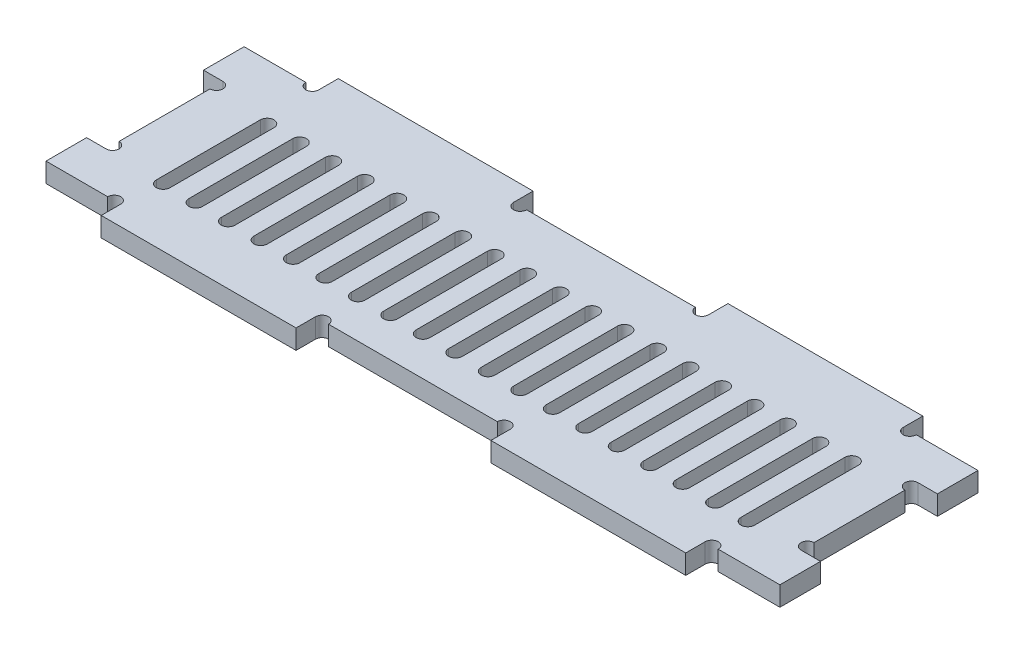
from build123d import *

# Parameters (mm, degrees)
EXTRUDE_1_DEPTH        = 1.5
SKETCH_2_W             = 94.999999969
SKETCH_2_H             = 7.3
CUT_EXTRUDE_1_DEPTH    = 10
SKETCH_4_W             = 94.999999969
SKETCH_4_H             = 4
CUT_EXTRUDE_3_DEPTH    = 10
SKETCH_5_W             = 30
SKETCH_5_H             = 3
EXTRUDE_2_DEPTH        = 3
EXTRUDE_3_DEPTH        = 3
SKETCH_7_R             = 1
CUT_EXTRUDE_4_DEPTH    = 3
CUT_EXTRUDE_5_DEPTH    = 5
PATTERN_LINEAR_1_COUNT = 19
PATTERN_LINEAR_1_PITCH = 5


with BuildPart() as part:
    # 草图1 → 凸台-拉伸1 (new, symmetric)
    with BuildSketch(Plane(origin=(0, 0, 0), x_dir=(1, 0, 0), z_dir=(0, 1, 0))):
        Polygon((-47.5, 26.6), (-47.5, -15.2), (47.499999969, -15.2), (47.499999969, 26.600010084), align=None)
    extrude(amount=EXTRUDE_1_DEPTH, both=True)

    # 草图2 → 切除-拉伸1 (cut)
    with BuildSketch(Plane(origin=(0, 1.5, 0), x_dir=(1, 0, 0), z_dir=(0, 1, 0))):
        with Locations((-1.5e-08, -11.55)):
            Rectangle(SKETCH_2_W, SKETCH_2_H)
    extrude(amount=-CUT_EXTRUDE_1_DEPTH, mode=Mode.SUBTRACT)

    # 草图4 → 切除-拉伸3 (cut)
    with BuildSketch(Plane(origin=(0, 1.5, 0), x_dir=(1, 0, 0), z_dir=(0, 1, 0))):
        with Locations((-1.5e-08, 24.6)):
            Rectangle(SKETCH_4_W, SKETCH_4_H)
    extrude(amount=-CUT_EXTRUDE_3_DEPTH, mode=Mode.SUBTRACT)


with BuildPart() as cut_extrude_3_kept_piece:
    # of the separate pieces the step leaves, the one the design keeps (cut_extrude_3_pieces_kept)
    add(part.part.solids().sort_by_distance((-47.5, 1.5, -22.6))[0])

    # 草图5 → 凸台-拉伸2 (add)
    with BuildSketch(Plane(origin=(0, 0, -22.6), x_dir=(-1, 0, 0), z_dir=(0, 0, -1))):
        with Locations((30, 0)):
            Rectangle(SKETCH_5_W, SKETCH_5_H)
        with Locations((-30, 0)):
            Rectangle(SKETCH_5_W, SKETCH_5_H)
    extrude_2 = extrude(amount=EXTRUDE_2_DEPTH)

    # 镜向1: 凸台-拉伸2 across plane
    add(extrude_2.mirror(Plane(origin=(0, 0, -7.35), x_dir=(1, 0, 0), z_dir=(0, 0, -1))))

    # 草图8 → 凸台-拉伸3 (add)
    with BuildSketch(Plane(origin=(0, 1.5, 0), x_dir=(1, 0, 0), z_dir=(0, 1, 0))):
        Polygon((-47.5, -7.9), (-47.5, 22.6), (-56.5, 22.6), (-56.5, 16.35), (-53.5, 16.35), (-53.5, -1.65), (-56.5, -1.65), (-56.5, -7.9), align=None)
        Polygon((56.5, -7.9), (56.5, -1.65), (53.5, -1.65), (53.5, 16.35), (56.5, 16.35), (56.5, 22.6), (47.5, 22.6), (47.5, -7.9), align=None)
    extrude(amount=-EXTRUDE_3_DEPTH)

    # 草图7 → 切除-拉伸4 (cut)
    with BuildSketch(Plane(origin=(0, 1.5, 0), x_dir=(1, 0, 0), z_dir=(0, 1, 0))):
        with Locations((-14, 22.6)):
            Circle(SKETCH_7_R)
        with Locations((14, 22.6)):
            Circle(SKETCH_7_R)
        with Locations((46, 22.6)):
            Circle(SKETCH_7_R)
        with Locations((46, -7.9)):
            Circle(SKETCH_7_R)
        with Locations((14, -7.9)):
            Circle(SKETCH_7_R)
        with Locations((-14, -7.9)):
            Circle(SKETCH_7_R)
        with Locations((-46, -7.9)):
            Circle(SKETCH_7_R)
        with Locations((-46, 22.6)):
            Circle(SKETCH_7_R)
        with Locations((-53.5, 15.35)):
            Circle(SKETCH_7_R)
        with Locations((-53.5, -0.65)):
            Circle(SKETCH_7_R)
        with Locations((53.5, -0.65)):
            Circle(SKETCH_7_R)
        with Locations((53.5, 15.35)):
            Circle(SKETCH_7_R)
    extrude(amount=-CUT_EXTRUDE_4_DEPTH, mode=Mode.SUBTRACT)

    # 草图9 → 切除-拉伸5 (cut)
    with BuildSketch(Plane(origin=(0, 1.5, 0), x_dir=(1, 0, 0), z_dir=(0, 1, 0))):
        with BuildLine():
            Line((-45.5, -1.9), (-45.5, 14.1))
            ThreePointArc((-45.5, 14.1), (-44.45, 15.15), (-43.4, 14.1))
            Line((-43.4, 14.1), (-43.4, -1.9))
            ThreePointArc((-43.4, -1.9), (-44.45, -2.95), (-45.5, -1.9))
        make_face()
    cut_extrude_5 = extrude(amount=-CUT_EXTRUDE_5_DEPTH, mode=Mode.SUBTRACT)

    # 阵列(线性)1: 切除-拉伸5 ×19
    with Locations(*[(i * PATTERN_LINEAR_1_PITCH, 0, 0) for i in range(1, PATTERN_LINEAR_1_COUNT)]):
        add(cut_extrude_5, mode=Mode.SUBTRACT)


solid = cut_extrude_3_kept_piece.part
